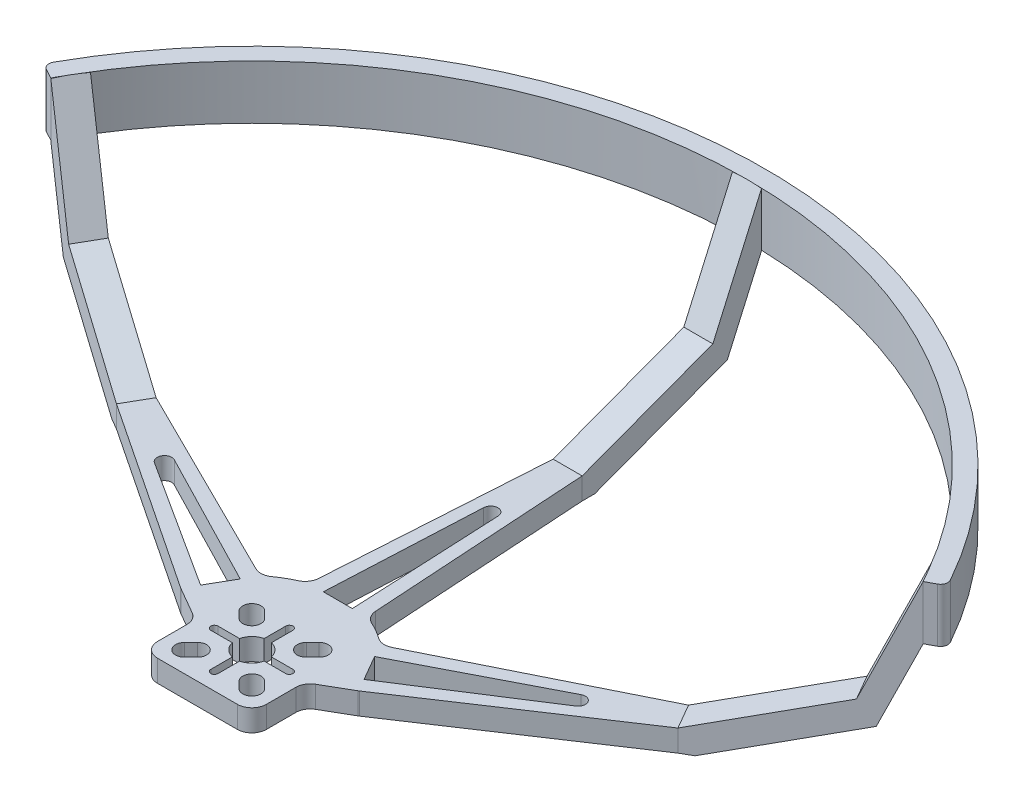
from build123d import *

# Parameters (mm, degrees)
SKETCH1_W                       = 15
SKETCH1_H                       = 15
BOSS_EXTRUDE1_DEPTH             = 3
BOSS_EXTRUDE2_START             = -1.18
SKETCH7_W                       = 8
SKETCH7_H                       = 3
BOSS_EXTRUDE2_DEPTH             = 6.18
CIRPATTERN2_COUNT               = 2
CIRPATTERN2_ANGLE               = 60
CIRPATTERN2_THE_OTHER_WAY_COUNT = 2
CIRPATTERN2_THE_OTHER_WAY_ANGLE = 60
TAP_DRILL_FOR_M3_TAP1_D         = 2.5
BOSS_EXTRUDE4_DEPTH             = 3
CUT_EXTRUDE1_START              = -10
CUT_EXTRUDE1_DEPTH              = 10
FILLET12_R                      = 2
SKETCH22_W                      = 31
SKETCH22_H                      = 3
BOSS_EXTRUDE11_DEPTH            = 4
CIRPATTERN8_COUNT               = 2
CIRPATTERN8_ANGLE               = 60
CIRPATTERN8_THE_OTHER_WAY_COUNT = 2
CIRPATTERN8_THE_OTHER_WAY_ANGLE = 60
CUT_EXTRUDE2_DEPTH              = 15
FILLET13_R                      = 2
BOSS_EXTRUDE12_DEPTH            = 2
CIRPATTERN9_COUNT               = 2
CIRPATTERN9_ANGLE               = 60
CIRPATTERN9_THE_OTHER_WAY_COUNT = 2
CIRPATTERN9_THE_OTHER_WAY_ANGLE = 60
SKETCH25_W                      = 2.5
SKETCH25_H                      = 7.427363245
REVOLVE1_ANGLE                  = 61.68
REVOLVE1_OTHER_WAY_ANGLE        = 61.68
FILLET14_R                      = 1


with BuildPart() as part:
    # Sketch1 → Boss-Extrude1 (new body)
    with BuildSketch(Plane(origin=(0, 0, 0), x_dir=(1, 0, 0), z_dir=(0, 1, 0))):
        Rectangle(SKETCH1_W, SKETCH1_H)
    extrude(amount=BOSS_EXTRUDE1_DEPTH)

    # Sketch7 → Boss-Extrude2 (add)
    with BuildSketch(Plane(origin=(0, 0, -7.5), x_dir=(-1, 0, 0), z_dir=(0, 0, -1)).offset(BOSS_EXTRUDE2_START)):
        with Locations((0, 1.5)):
            Rectangle(SKETCH7_W, SKETCH7_H)
    boss_extrude2 = extrude(amount=BOSS_EXTRUDE2_DEPTH)

    # CirPattern2: Boss-Extrude2 ×2 about axis
    cirpattern2_axis = Axis((0, 0, 0), (0, -1, 0))
    for i in range(1, CIRPATTERN2_COUNT):
        add(boss_extrude2.rotate(cirpattern2_axis, i * CIRPATTERN2_ANGLE / (CIRPATTERN2_COUNT - 1)))

    # CirPattern2 the other way: Boss-Extrude2 ×2 about axis
    cirpattern2_the_other_way_axis = Axis((0, 0, 0), (0, 1, 0))
    for i in range(1, CIRPATTERN2_THE_OTHER_WAY_COUNT):
        add(boss_extrude2.rotate(cirpattern2_the_other_way_axis, i * CIRPATTERN2_THE_OTHER_WAY_ANGLE / (CIRPATTERN2_THE_OTHER_WAY_COUNT - 1)))

    # Tap Drill for M3 Tap1 (through all)
    with Locations(Plane(origin=(0, 3, 0), x_dir=(1, 0, 0), z_dir=(0, 1, 0))):
        with Locations((-3.75, -3.75), (-3.75, 3.75), (3.75, -3.75), (3.75, 3.75)):
            Hole(TAP_DRILL_FOR_M3_TAP1_D / 2)

    # Sketch10 → Boss-Extrude4 (add)
    with BuildSketch(Plane(origin=(0, 3, 0), x_dir=(1, 0, 0), z_dir=(0, 1, 0))):
        with BuildLine():
            Line((4.990381057, 7.5), (8.256095748, 9.385461256))
            ThreePointArc((8.256095748, 9.385461256), (6.25, 10.825317547), (4, 11.842719282))
            Line((4, 11.842719282), (4, 7.5))
            Line((4, 7.5), (4.990381057, 7.5))
        make_face()
        with BuildLine():
            ThreePointArc((-4, 11.842719282), (-6.25, 10.825317547), (-8.256095748, 9.385461256))
            Line((-8.256095748, 9.385461256), (-4.990381057, 7.5))
            Line((-4.990381057, 7.5), (-4, 7.5))
            Line((-4, 7.5), (-4, 11.842719282))
        make_face()
    extrude(amount=-BOSS_EXTRUDE4_DEPTH)

    # Sketch21 → Cut-Extrude1 (cut)
    with BuildSketch(Plane(origin=(0, 3, 0), x_dir=(1, 0, 0), z_dir=(0, 1, 0)).offset(CUT_EXTRUDE1_START)):
        with BuildLine():
            ThreePointArc((-4.633883476, 2.866116524), (-4.633883476, 4.633883476), (-2.866116524, 4.633883476))
            Line((-2.866116524, 4.633883476), (-3.396446609, 5.164213562))
            Line((-3.396446609, 5.164213562), (-3.75, 5.517766953))
            ThreePointArc((-3.75, 5.517766953), (-5.517766953, 5.517766953), (-5.517766953, 3.75))
            Line((-5.517766953, 3.75), (-4.633883476, 2.866116524))
        make_face()
        with BuildLine():
            ThreePointArc((-0.5, 2.193741097), (-1.590990258, 1.590990258), (-2.193741097, 0.5))
            Line((-2.193741097, 0.5), (-5.164213562, 0.5))
            ThreePointArc((-5.164213562, 0.5), (-5.664213562, 0), (-5.164213562, -0.5))
            Line((-5.164213562, -0.5), (-2.193741097, -0.5))
            ThreePointArc((-2.193741097, -0.5), (-1.590990258, -1.590990258), (-0.5, -2.193741097))
            Line((-0.5, -2.193741097), (-0.5, -5.164213562))
            ThreePointArc((-0.5, -5.164213562), (0, -5.664213562), (0.5, -5.164213562))
            Line((0.5, -5.164213562), (0.5, -2.193741097))
            ThreePointArc((0.5, -2.193741097), (1.590990258, -1.590990258), (2.193741097, -0.5))
            Line((2.193741097, -0.5), (5.164213562, -0.5))
            ThreePointArc((5.164213562, -0.5), (5.664213562, 0), (5.164213562, 0.5))
            Line((5.164213562, 0.5), (2.193741097, 0.5))
            ThreePointArc((2.193741097, 0.5), (1.590990258, 1.590990258), (0.5, 2.193741097))
            Line((0.5, 2.193741097), (0.5, 5.164213562))
            ThreePointArc((0.5, 5.164213562), (0, 5.664213562), (-0.5, 5.164213562))
            Line((-0.5, 5.164213562), (-0.5, 2.193741097))
        make_face()
        with BuildLine():
            Line((3.75, 5.517766953), (3.396446609, 5.164213562))
            Line((3.396446609, 5.164213562), (2.866116524, 4.633883476))
            ThreePointArc((2.866116524, 4.633883476), (4.633883476, 4.633883476), (4.633883476, 2.866116524))
            Line((4.633883476, 2.866116524), (5.517766953, 3.75))
            ThreePointArc((5.517766953, 3.75), (5.517766953, 5.517766953), (3.75, 5.517766953))
        make_face()
        with BuildLine():
            Line((5.517766953, -3.75), (4.633883476, -2.866116524))
            ThreePointArc((4.633883476, -2.866116524), (4.633883476, -4.633883476), (2.866116524, -4.633883476))
            Line((2.866116524, -4.633883476), (3.75, -5.517766953))
            ThreePointArc((3.75, -5.517766953), (5.517766953, -5.517766953), (5.517766953, -3.75))
        make_face()
        with BuildLine():
            Line((-4.633883476, -2.866116524), (-5.517766953, -3.75))
            ThreePointArc((-5.517766953, -3.75), (-5.517766953, -5.517766953), (-3.75, -5.517766953))
            Line((-3.75, -5.517766953), (-2.866116524, -4.633883476))
            ThreePointArc((-2.866116524, -4.633883476), (-4.633883476, -4.633883476), (-4.633883476, -2.866116524))
        make_face()
    extrude(amount=CUT_EXTRUDE1_DEPTH, mode=Mode.SUBTRACT)

    # Fillet12
    fillet12_edges = [part.edges().sort_by_distance(p)[0] for p in [
        (7.5, 1.5, 7.5),
        (-7.5, 1.5, 7.5),
    ]]
    fillet(fillet12_edges, radius=FILLET12_R)

    # Sketch22 → Boss-Extrude11 (add, symmetric)
    with BuildSketch(Plane(origin=(0, 0, 0), x_dir=(0, 0, -1), z_dir=(1, 0, 0))):
        with Locations((28, 1.5)):
            Rectangle(SKETCH22_W, SKETCH22_H)
    boss_extrude11 = extrude(amount=BOSS_EXTRUDE11_DEPTH, both=True)

    # CirPattern8: Boss-Extrude11 ×2 about axis
    cirpattern8_axis = Axis((0, 0, 0), (0, 1, 0))
    for i in range(1, CIRPATTERN8_COUNT):
        add(boss_extrude11.rotate(cirpattern8_axis, i * CIRPATTERN8_ANGLE / (CIRPATTERN8_COUNT - 1)))

    # CirPattern8 the other way: Boss-Extrude11 ×2 about axis
    cirpattern8_the_other_way_axis = Axis((0, 0, 0), (0, -1, 0))
    for i in range(1, CIRPATTERN8_THE_OTHER_WAY_COUNT):
        add(boss_extrude11.rotate(cirpattern8_the_other_way_axis, i * CIRPATTERN8_THE_OTHER_WAY_ANGLE / (CIRPATTERN8_THE_OTHER_WAY_COUNT - 1)))

    # Sketch23 → Cut-Extrude2 (cut)
    with BuildSketch(Plane(origin=(0, 3, 0), x_dir=(1, 0, 0), z_dir=(0, 1, 0))):
        with BuildLine():
            Line((0, 11.842719282), (2, 11.842719282))
            Line((2, 11.842719282), (1, 32.898140757))
            ThreePointArc((1, 32.898140757), (0, 33.898140757), (-1, 32.898140757))
            Line((-1, 32.898140757), (-2, 11.842719282))
            Line((-2, 11.842719282), (0, 11.842719282))
        make_face()
        Polygon((2, 43.5), (4, 11.842719282), (4, 43.5), align=None)
        Polygon((35.672105065, 25.214101615), (8.256095748, 9.385461256), (36.672105065, 23.482050808), align=None)
        Polygon((-4, 43.5), (-4, 11.842719282), (-2, 43.5), align=None)
        with BuildLine():
            Line((27.990625633, 17.315095782), (9.256095748, 7.653410449))
            Line((9.256095748, 7.653410449), (11.256095748, 4.189308834))
            Line((11.256095748, 4.189308834), (28.990625633, 15.583044975))
            ThreePointArc((28.990625633, 15.583044975), (29.356651037, 16.949070379), (27.990625633, 17.315095782))
        make_face()
        Polygon((-36.672105065, 23.482050808), (-8.256095748, 9.385461256), (-35.672105065, 25.214101615), align=None)
        Polygon((39.672105065, 18.285898385), (38.672105065, 20.017949192), (12.256095748, 2.457258026), align=None)
        with BuildLine():
            Line((-11.256095748, 4.189308834), (-9.256095748, 7.653410449))
            Line((-9.256095748, 7.653410449), (-27.990625633, 17.315095782))
            ThreePointArc((-27.990625633, 17.315095782), (-29.356651037, 16.949070379), (-28.990625633, 15.583044975))
            Line((-28.990625633, 15.583044975), (-11.256095748, 4.189308834))
        make_face()
        Polygon((-12.256095748, 2.457258026), (-38.672105065, 20.017949192), (-39.672105065, 18.285898385), align=None)
    extrude(amount=-CUT_EXTRUDE2_DEPTH, mode=Mode.SUBTRACT)

    # Fillet13
    fillet13_edges = [part.edges().sort_by_distance(p)[0] for p in [
        (4, 1.5, -11.842719282),
        (8.256095748, 1.5, -9.385461256),
        (12.256095748, 1.5, -2.457258026),
        (-12.256095748, 1.5, -2.457258026),
        (7.5, 1.5, 0.288675135),
        (-7.5, 1.5, 0.288675135),
        (-8.256095748, 1.5, -9.385461256),
        (-4, 1.5, -11.842719282),
    ]]
    fillet(fillet13_edges, radius=FILLET13_R)

    # Sketch24 → Boss-Extrude12 (add, symmetric)
    with BuildSketch(Plane(origin=(0, 0, 0), x_dir=(0, 0, -1), z_dir=(1, 0, 0))):
        Polygon((68.233351235, 25), (68.233351235, 17.572636755), (63.498764769, 6.849530075), (45.233351235, 0), (43.5, 0), (43.5, 3), (61.5, 9.75), align=None)
    boss_extrude12 = extrude(amount=BOSS_EXTRUDE12_DEPTH, both=True)

    # CirPattern9: Boss-Extrude12 ×2 about axis
    cirpattern9_axis = Axis((0, 0, 0), (0, 1, 0))
    for i in range(1, CIRPATTERN9_COUNT):
        add(boss_extrude12.rotate(cirpattern9_axis, i * CIRPATTERN9_ANGLE / (CIRPATTERN9_COUNT - 1)))

    # CirPattern9 the other way: Boss-Extrude12 ×2 about axis
    cirpattern9_the_other_way_axis = Axis((0, 0, 0), (0, -1, 0))
    for i in range(1, CIRPATTERN9_THE_OTHER_WAY_COUNT):
        add(boss_extrude12.rotate(cirpattern9_the_other_way_axis, i * CIRPATTERN9_THE_OTHER_WAY_ANGLE / (CIRPATTERN9_THE_OTHER_WAY_COUNT - 1)))

    # Sketch25 → Revolve1 (revolve)
    with BuildSketch(Plane(origin=(0, 0, 0), x_dir=(0, 0, -1), z_dir=(1, 0, 0))):
        with Locations((69.483351235, 21.286318378)):
            Rectangle(SKETCH25_W, SKETCH25_H)
    revolve(axis=Axis((0, 0, 0), (0, 1, 0)), revolution_arc=REVOLVE1_ANGLE)

    # Sketch25 → Revolve1 other way (revolve)
    with BuildSketch(Plane(origin=(0, 0, 0), x_dir=(0, 0, -1), z_dir=(1, 0, 0))):
        with Locations((69.483351235, 21.286318378)):
            Rectangle(SKETCH25_W, SKETCH25_H)
    revolve(axis=Axis((0, 0, 0), (0, -1, 0)), revolution_arc=REVOLVE1_OTHER_WAY_ANGLE)

    # Fillet14
    fillet14_edges = [part.edges().sort_by_distance(p)[0] for p in [
        (-62.267404585, 21.286318378, -33.555585275),
        (62.267404585, 21.286318378, -33.555585275),
    ]]
    fillet(fillet14_edges, radius=FILLET14_R)


solid = part.part
